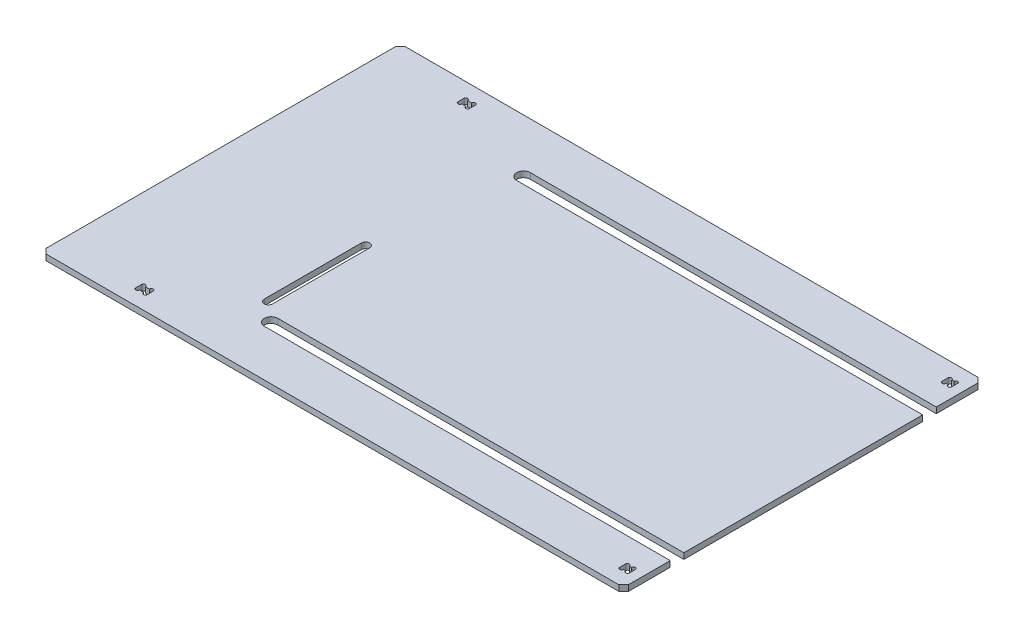
from build123d import *

# Parameters (mm, degrees)
SKETCH_1_W           = 300
SKETCH_1_H           = 185
EXTRUDE_1_DEPTH      = 3
CUT_EXTRUDE_1_DEPTH  = 10
SKETCH_3_R           = 2.15
CUT_EXTRUDE_2_DEPTH  = 10
SKETCH_4_W           = 209.1
SKETCH_4_H           = 7
CUT_EXTRUDE_3_DEPTH  = 10
SKETCH_5_R           = 3.5
CUT_EXTRUDE_5_DEPTH  = 10
CHAMFER_1_SIZE       = 2.5
SKETCH_9_W           = 5
SKETCH_9_H           = 3
SKETCH_9_W_2         = 6
CUT_EXTRUDE_9_DEPTH  = 10
SKETCH_10_R          = 0.965981561
CUT_EXTRUDE_10_DEPTH = 10


with BuildPart() as part:
    # 스케치1 → 보스-돌출1 (new body)
    with BuildSketch(Plane(origin=(0, 0, 0), x_dir=(1, 0, 0), z_dir=(0, 1, 0))):
        with Locations((150, 92.5)):
            Rectangle(SKETCH_1_W, SKETCH_1_H)
    extrude(amount=EXTRUDE_1_DEPTH)

    # 스케치2 → 컷-돌출1 (cut)
    with BuildSketch(Plane(origin=(0, 3, 0), x_dir=(1, 0, 0), z_dir=(0, 1, 0))):
        Polygon((78.8, 61.106579113), (78.8, 86.106579113), (83.1, 86.106579113), (83.1, 36.106579113), (78.8, 36.106579113), align=None)
    extrude(amount=-CUT_EXTRUDE_1_DEPTH, mode=Mode.SUBTRACT)

    # 스케치3 → 컷-돌출2 (cut)
    with BuildSketch(Plane(origin=(0, 3, 0), x_dir=(1, 0, 0), z_dir=(0, 1, 0))):
        with Locations((80.95, 86.106579113)):
            Circle(SKETCH_3_R)
        with Locations((80.95, 36.106579113)):
            Circle(SKETCH_3_R)
    extrude(amount=-CUT_EXTRUDE_2_DEPTH, mode=Mode.SUBTRACT)

    # 스케치4 → 컷-돌출3 (cut)
    with BuildSketch(Plane(origin=(0, 3, 0), x_dir=(1, 0, 0), z_dir=(0, 1, 0))):
        with Locations((195.45, 157.5)):
            Rectangle(SKETCH_4_W, SKETCH_4_H)
        with Locations((195.45, 27.5)):
            Rectangle(SKETCH_4_W, SKETCH_4_H)
    extrude(amount=-CUT_EXTRUDE_3_DEPTH, mode=Mode.SUBTRACT)

    # 스케치5 → 컷-돌출5 (cut)
    with BuildSketch(Plane(origin=(0, 3, 0), x_dir=(1, 0, 0), z_dir=(0, 1, 0))):
        with Locations((90.9, 157.5)):
            Circle(SKETCH_5_R)
        with Locations((90.9, 27.5)):
            Circle(SKETCH_5_R)
    extrude(amount=-CUT_EXTRUDE_5_DEPTH, mode=Mode.SUBTRACT)

    # 모따기1
    chamfer_1_edges = [part.edges().sort_by_distance(p)[0] for p in [
        (0, 1.5, -185),
        (300, 1.5, -185),
        (300, 1.5, 0),
        (0, 1.5, 0),
    ]]
    chamfer(chamfer_1_edges, length=CHAMFER_1_SIZE)

    # 스케치9 → 컷-돌출9 (cut)
    with BuildSketch(Plane.XZ):
        with Locations((292.5, -175.5)):
            Rectangle(SKETCH_9_W, SKETCH_9_H)
        with Locations((43.7, -175.5)):
            Rectangle(SKETCH_9_W_2, SKETCH_9_H)
        with Locations((43.7, -9.5)):
            Rectangle(SKETCH_9_W_2, SKETCH_9_H)
        with Locations((292.5, -9.5)):
            Rectangle(SKETCH_9_W, SKETCH_9_H)
    extrude(amount=-CUT_EXTRUDE_9_DEPTH, mode=Mode.SUBTRACT)

    # 스케치10 → 컷-돌출10 (cut)
    with BuildSketch(Plane(origin=(0, 3, 0), x_dir=(1, 0, 0), z_dir=(0, 1, 0))):
        with Locations((294.034018439, 174)):
            Circle(SKETCH_10_R)
        with Locations((290.965981561, 174)):
            Circle(SKETCH_10_R)
        with Locations((290.965981561, 177)):
            Circle(SKETCH_10_R)
        with Locations((294.034018439, 177)):
            Circle(SKETCH_10_R)
        with Locations((41.665981561, 174)):
            Circle(SKETCH_10_R)
        with Locations((41.665981561, 177)):
            Circle(SKETCH_10_R)
        with Locations((45.734018439, 177)):
            Circle(SKETCH_10_R)
        with Locations((45.734018439, 174)):
            Circle(SKETCH_10_R)
        with Locations((45.734018439, 11)):
            Circle(SKETCH_10_R)
        with Locations((45.734018439, 8)):
            Circle(SKETCH_10_R)
        with Locations((41.665981561, 8)):
            Circle(SKETCH_10_R)
        with Locations((41.665981561, 11)):
            Circle(SKETCH_10_R)
        with Locations((294.034018439, 8)):
            Circle(SKETCH_10_R)
        with Locations((290.965981561, 8)):
            Circle(SKETCH_10_R)
        with Locations((290.965981561, 11)):
            Circle(SKETCH_10_R)
        with Locations((294.034018439, 11)):
            Circle(SKETCH_10_R)
    extrude(amount=-CUT_EXTRUDE_10_DEPTH, mode=Mode.SUBTRACT)


solid = part.part
